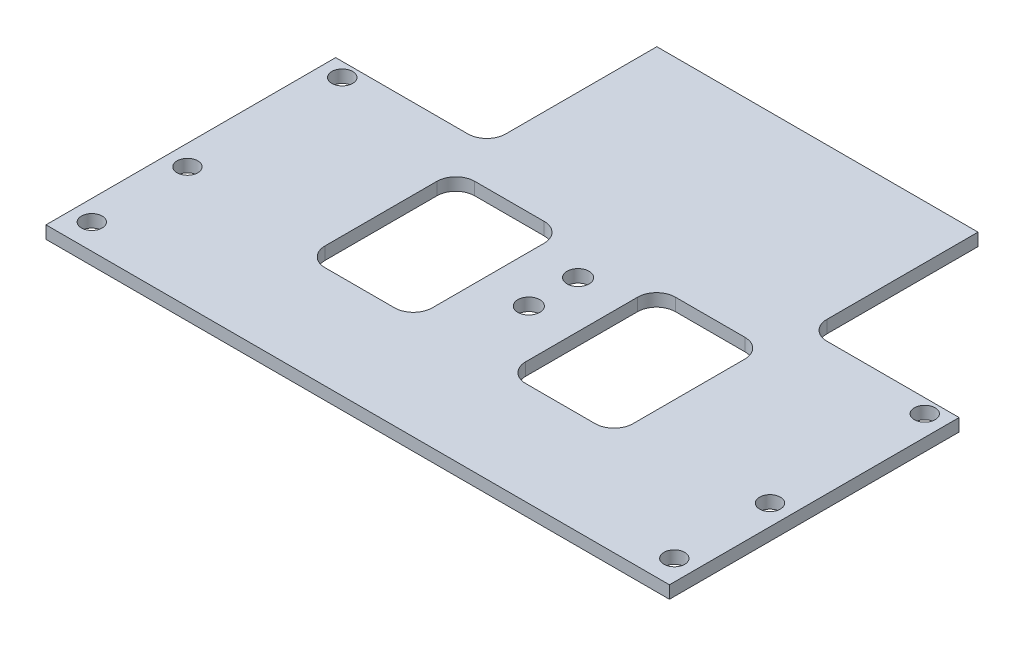
from build123d import *

# Parameters (mm, degrees)
CROQUIS1_R              = 1.65
CROQUIS1_R_2            = 1.75
SALIENTE_EXTRUIR1_DEPTH = 2


with BuildPart() as part:
    # Croquis1 → Saliente-Extruir1 (new body)
    with BuildSketch(Plane(origin=(0, 0, 0), x_dir=(1, 0, 0), z_dir=(0, 1, 0))):
        with BuildLine():
            Line((-28.5, 9.5), (-49.5, 9.5))
            Line((-49.5, 9.5), (-49.5, -36.5))
            Line((-49.5, -36.5), (49.5, -36.5))
            Line((49.5, -36.5), (49.5, 9.5))
            Line((49.5, 9.5), (28.5, 9.5))
            ThreePointArc((28.5, 9.5), (26.378679656, 10.378679656), (25.5, 12.5))
            Line((25.5, 12.5), (25.5, 36.5))
            Line((25.5, 36.5), (-25.5, 36.5))
            Line((-25.5, 36.5), (-25.5, 12.5))
            ThreePointArc((-25.5, 12.5), (-26.378679656, 10.378679656), (-28.5, 9.5))
        make_face()
        with Locations(Location((-46.25, -32.474277755, 0), (0, 0, 270))):
            Circle(CROQUIS1_R, mode=Mode.SUBTRACT)
        with Locations(Location((-46.25, -17.286108292, 0), (0, 0, 270))):
            Circle(CROQUIS1_R, mode=Mode.SUBTRACT)
        with Locations(Location((0, -9.329285485, 0), (0, 0, 270))):
            Circle(CROQUIS1_R_2, mode=Mode.SUBTRACT)
        with BuildLine():
            ThreePointArc((-10.417011027, 3.530475001), (-8.295690684, 2.651795344), (-7.417011027, 0.530475001))
            Line((-7.417011027, 0.530475001), (-7.417011027, -17.238029314))
            ThreePointArc((-7.417011027, -17.238029314), (-8.295690684, -19.359349658), (-10.417011027, -20.238029314))
            Line((-10.417011027, -20.238029314), (-21.450841414, -20.238029314))
            ThreePointArc((-21.450841414, -20.238029314), (-23.572161757, -19.359349658), (-24.450841414, -17.238029314))
            Line((-24.450841414, -17.238029314), (-24.450841414, 0.530475001))
            ThreePointArc((-24.450841414, 0.530475001), (-23.572161757, 2.651795344), (-21.450841414, 3.530475001))
            Line((-21.450841414, 3.530475001), (-10.417011027, 3.530475001))
        make_face(mode=Mode.SUBTRACT)
        with Locations(Location((0, -1.504051409, 0), (0, 0, 270))):
            Circle(CROQUIS1_R_2, mode=Mode.SUBTRACT)
        with Locations(Location((46.25, -32.474277755, 0), (0, 0, 270))):
            Circle(CROQUIS1_R, mode=Mode.SUBTRACT)
        with BuildLine():
            Line((10.417011027, 3.530475001), (21.450841414, 3.530475001))
            ThreePointArc((21.450841414, 3.530475001), (23.572161757, 2.651795344), (24.450841414, 0.530475001))
            Line((24.450841414, 0.530475001), (24.450841414, -17.238029314))
            ThreePointArc((24.450841414, -17.238029314), (23.572161757, -19.359349658), (21.450841414, -20.238029314))
            Line((21.450841414, -20.238029314), (10.417011027, -20.238029314))
            ThreePointArc((10.417011027, -20.238029314), (8.295690684, -19.359349658), (7.417011027, -17.238029314))
            Line((7.417011027, -17.238029314), (7.417011027, 0.530475001))
            ThreePointArc((7.417011027, 0.530475001), (8.295690684, 2.651795344), (10.417011027, 3.530475001))
        make_face(mode=Mode.SUBTRACT)
        with Locations(Location((46.25, -17.286108292, 0), (0, 0, 270))):
            Circle(CROQUIS1_R, mode=Mode.SUBTRACT)
        with Locations(Location((-46.25, 7.294463352, 0), (0, 0, 270))):
            Circle(CROQUIS1_R, mode=Mode.SUBTRACT)
        with Locations(Location((46.25, 7.294463352, 0), (0, 0, 270))):
            Circle(CROQUIS1_R, mode=Mode.SUBTRACT)
    extrude(amount=SALIENTE_EXTRUIR1_DEPTH)


solid = part.part
